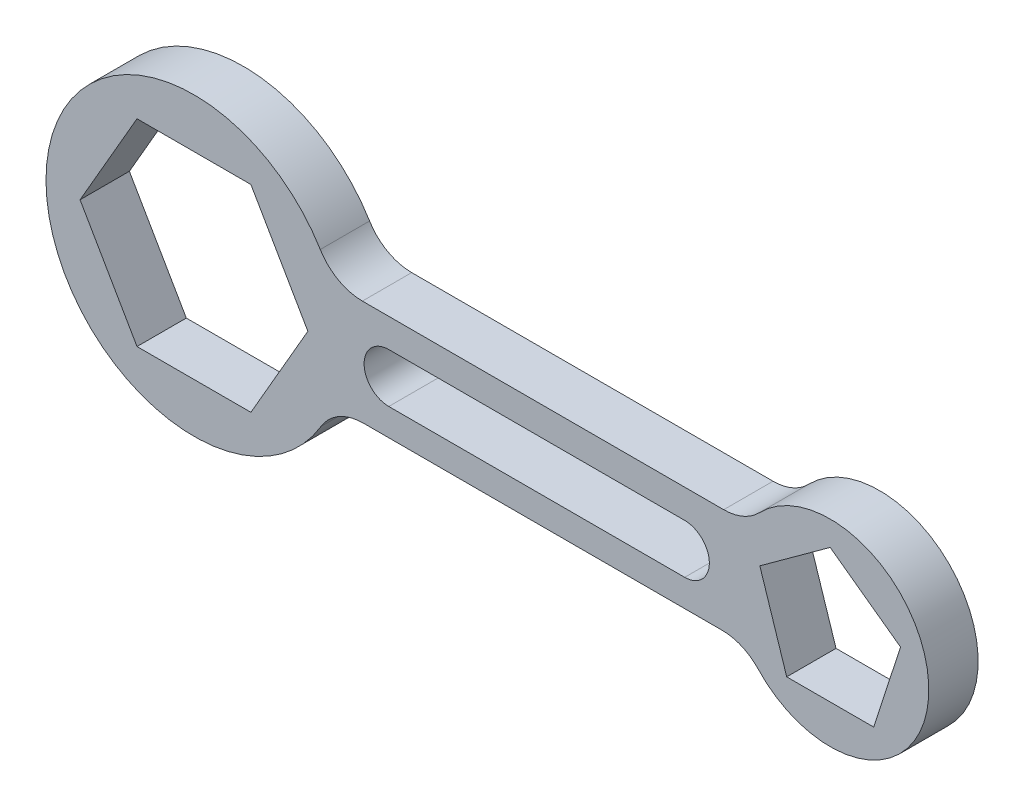
from build123d import *

# Parameters (mm, degrees)
BOSS_EXTRUDE1_DEPTH = 10


with BuildPart() as part:
    # Sketch1 → Boss-Extrude1 (new body)
    with BuildSketch(Plane.XY):
        with BuildLine():
            Line((34.148205858, 10.830267321), (107.410651623, 10.830267321))
            ThreePointArc((107.410651623, 10.830267321), (111.319985045, 11.626077395), (114.607101082, 13.886844881))
            ThreePointArc((114.607101082, 13.886844881), (148.999427872, -0.151277258), (114.398677604, -13.667530292))
            ThreePointArc((114.398677604, -13.667530292), (111.076857226, -11.326938473), (107.098016406, -10.501295438))
            Line((107.098016406, -10.501295438), (34.346715787, -10.501295438))
            ThreePointArc((34.346715787, -10.501295438), (29.409775368, -11.80493877), (25.76003684, -15.375971579))
            ThreePointArc((25.76003684, -15.375971579), (-29.999653993, -0.144084298), (25.611154394, 15.622700491))
            ThreePointArc((25.611154394, 15.622700491), (29.253089327, 12.110299767), (34.148205858, 10.830267321))
        make_face()
        Polygon((11.547005384, 20), (-11.547005384, 20), (-23.094010768, 0), (-11.547005384, -20), (11.547005384, -20), (23.094010768, 0), align=None, mode=Mode.SUBTRACT)
        Polygon((129, 15), (114.734152256, 4.635254916), (120.183221216, -12.135254916), (137.816778784, -12.135254916), (143.265847744, 4.635254916), align=None, mode=Mode.SUBTRACT)
        with BuildLine():
            Line((39.5, 5), (99.5, 5))
            ThreePointArc((99.5, 5), (104.5, 0), (99.5, -5))
            Line((99.5, -5), (39.5, -5))
            ThreePointArc((39.5, -5), (34.5, 0), (39.5, 5))
        make_face(mode=Mode.SUBTRACT)
    extrude(amount=BOSS_EXTRUDE1_DEPTH)


solid = part.part
